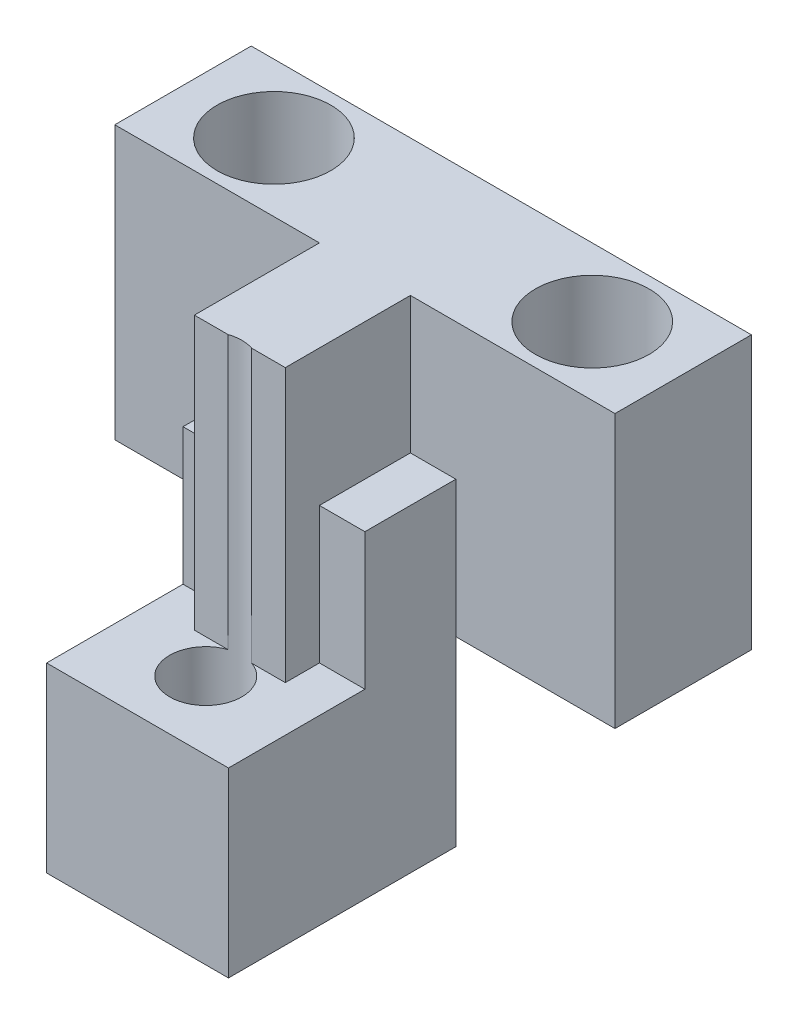
from build123d import *

# Parameters (mm, degrees)
SKETCH1_W                                   = 44
SKETCH1_H                                   = 24
CROSSHEAD_BASE_DEPTH                        = 12
SHOE_UPRISER_START                          = 12
SKETCH2_W                                   = 8
SKETCH2_H                                   = 24
SHOE_UPRISER_DEPTH                          = 11
ADAPTER_BRIDGE_START                        = 12
SKETCH3_W                                   = 16
SKETCH3_H                                   = 28
ADAPTER_BRIDGE_DEPTH                        = 8
THREADED_ROD_ADAPTER_START                  = 20
SKETCH4_W                                   = 16
SKETCH4_H                                   = 16
THREADED_ROD_ADAPTER_DEPTH                  = 12
TWO_BRONZE_BUSH_HOUSINGS_DEPTH              = 48.874836814
TWO_BRONZE_BUSH_HOUSINGS_DEPTH_BACK         = 48.874836814
SKETCH5_R                                   = 5
QUARTER20_ADAPTER_MAJOR_ENVELOPE_DEPTH      = 48.874836814
QUARTER20_ADAPTER_MAJOR_ENVELOPE_DEPTH_BACK = 48.874836814
SKETCH6_R                                   = 3.175


with BuildPart() as part:
    # Sketch1 → Crosshead_Base (new body)
    with BuildSketch(Plane.XY):
        Rectangle(SKETCH1_W, SKETCH1_H)
    extrude(amount=CROSSHEAD_BASE_DEPTH)

    # Sketch2 → Shoe_Upriser (add)
    with BuildSketch(Plane.XY.offset(SHOE_UPRISER_START)):
        Rectangle(SKETCH2_W, SKETCH2_H)
    extrude(amount=SHOE_UPRISER_DEPTH)

    # Sketch3 → Adapter_Bridge (add)
    with BuildSketch(Plane.XY.offset(ADAPTER_BRIDGE_START)):
        with Locations((0, -14)):
            Rectangle(SKETCH3_W, SKETCH3_H)
    extrude(amount=ADAPTER_BRIDGE_DEPTH)

    # Sketch4 → Threaded_Rod_Adapter (add)
    with BuildSketch(Plane.XY.offset(THREADED_ROD_ADAPTER_START)):
        with Locations((0, -20)):
            Rectangle(SKETCH4_W, SKETCH4_H)
    extrude(amount=THREADED_ROD_ADAPTER_DEPTH)

    # Sketch5 → Two_Bronze_Bush_Housings (cut, two sides: drawn at the far end of the back side and taken through both)
    with BuildSketch(Plane(origin=(0, 0, 0), x_dir=(1, 0, 0), z_dir=(0, 1, 0)).offset(-TWO_BRONZE_BUSH_HOUSINGS_DEPTH_BACK)):
        with Locations(Location((-14, -6, 0), (0, 0, 270))):
            Circle(SKETCH5_R)
        with Locations(Location((14, -6, 0), (0, 0, 270))):
            Circle(SKETCH5_R)
    extrude(amount=TWO_BRONZE_BUSH_HOUSINGS_DEPTH + TWO_BRONZE_BUSH_HOUSINGS_DEPTH_BACK, mode=Mode.SUBTRACT)

    # Sketch6 → Quarter20_Adapter_Major_Envelope (cut, two sides: drawn at the far end of the back side and taken through both)
    with BuildSketch(Plane(origin=(0, 0, 0), x_dir=(1, 0, 0), z_dir=(0, 1, 0)).offset(-QUARTER20_ADAPTER_MAJOR_ENVELOPE_DEPTH_BACK)):
        with Locations(Location((0, -26, 0), (0, 0, 270))):
            Circle(SKETCH6_R)
    extrude(amount=QUARTER20_ADAPTER_MAJOR_ENVELOPE_DEPTH + QUARTER20_ADAPTER_MAJOR_ENVELOPE_DEPTH_BACK, mode=Mode.SUBTRACT)


solid = part.part
